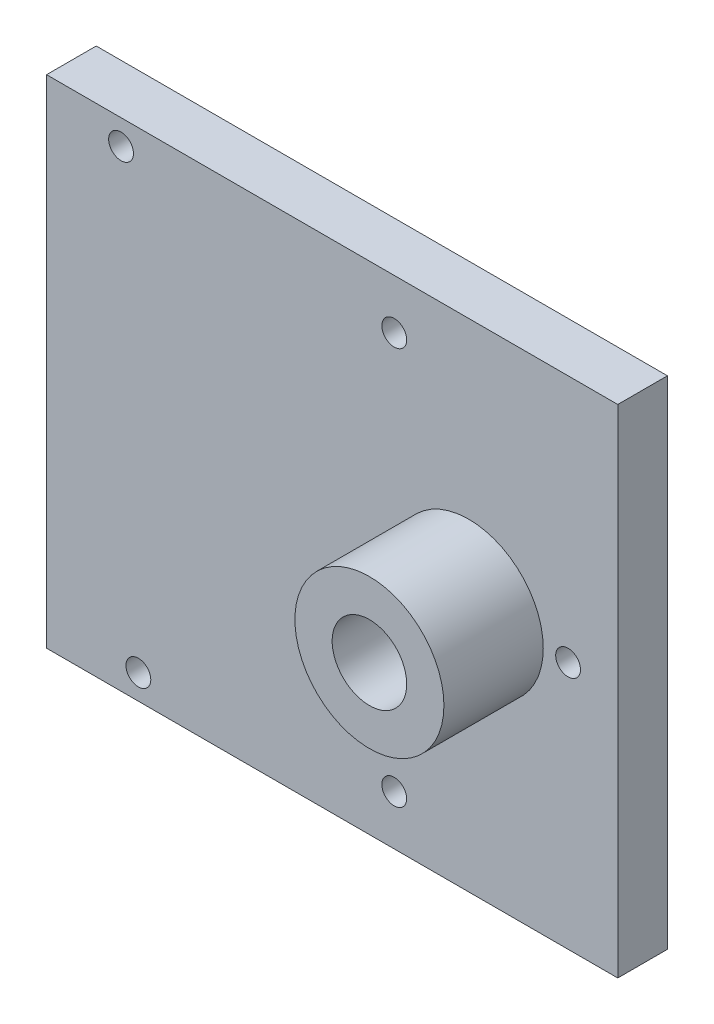
from build123d import *

# Parameters (mm, degrees)
SKETCH_1_W      = 23
SKETCH_1_H      = 20
SKETCH_1_R      = 0.5
SKETCH_1_R_2    = 1.5
EXTRUDE_1_DEPTH = 2
SKETCH_2_R      = 3
SKETCH_2_R_2    = 1.5
EXTRUDE_2_DEPTH = 4


with BuildPart() as part:
    # 草图1 → 凸台-拉伸1 (new body)
    with BuildSketch(Plane.XY):
        Rectangle(SKETCH_1_W, SKETCH_1_H)
        with Locations((-8.5, 9)):
            Circle(SKETCH_1_R, mode=Mode.SUBTRACT)
        with Locations((-7.803030303, -9)):
            Circle(SKETCH_1_R, mode=Mode.SUBTRACT)
        with Locations((9.5, 0)):
            Circle(SKETCH_1_R, mode=Mode.SUBTRACT)
        with Locations((2.5, 8)):
            Circle(SKETCH_1_R, mode=Mode.SUBTRACT)
        with Locations((2.5, -8)):
            Circle(SKETCH_1_R, mode=Mode.SUBTRACT)
        with Locations((5.5, 0)):
            Circle(SKETCH_1_R_2, mode=Mode.SUBTRACT)
    extrude(amount=EXTRUDE_1_DEPTH)

    # 草图2 → 凸台-拉伸2 (add)
    with BuildSketch(Plane.XY.offset(2)):
        with Locations((5.5, 0)):
            Circle(SKETCH_2_R)
        with Locations((5.5, 0)):
            Circle(SKETCH_2_R_2, mode=Mode.SUBTRACT)
    extrude(amount=EXTRUDE_2_DEPTH)


solid = part.part
